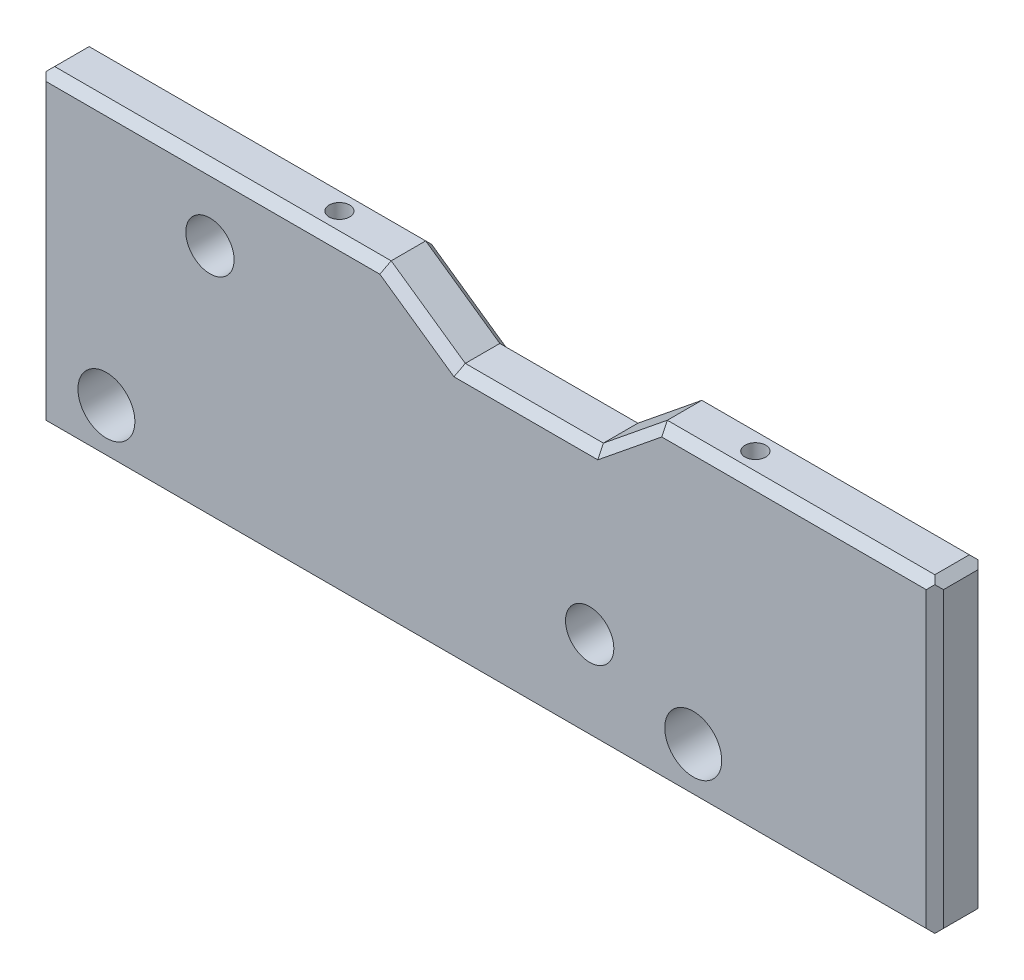
from build123d import *

# Parameters (mm, degrees)
SKETCH_1_R          = 1.4
SKETCH_1_R_2        = 1.65
EXTRUDE_1_DEPTH     = 3
SKETCH_2_R          = 0.6
CUT_EXTRUDE_1_DEPTH = 34.421549934
CHAMFER_2_SIZE      = 0.5
CHAMFER_3_SIZE      = 0.5


with BuildPart() as part:
    # 草图1 → 凸台-拉伸1 (new body)
    with BuildSketch(Plane.XY):
        Polygon((-8, 7), (-3.705865331, 4), (4.294134669, 4), (8, 7), (24, 7), (24, -11), (-28, -11), (-28, 7), align=None)
        with Locations((-18, 3)):
            Circle(SKETCH_1_R, mode=Mode.SUBTRACT)
        with Locations((4, -5.5)):
            Circle(SKETCH_1_R, mode=Mode.SUBTRACT)
        with Locations((-24, -8)):
            Circle(SKETCH_1_R_2, mode=Mode.SUBTRACT)
        with Locations((10, -8)):
            Circle(SKETCH_1_R_2, mode=Mode.SUBTRACT)
    extrude(amount=EXTRUDE_1_DEPTH)

    # 草图2 → 切除-拉伸1 (cut, through all)
    with BuildSketch(Plane.XZ.offset(11)):
        with Locations(Location((12.1, 1.5, 0), (0, 0, 270))):
            Circle(SKETCH_2_R)
        with Locations(Location((-12, 1.5, 0), (0, 0, 270))):
            Circle(SKETCH_2_R)
    extrude(amount=-CUT_EXTRUDE_1_DEPTH, mode=Mode.SUBTRACT)

    # 倒角2
    chamfer_2_edges = [part.edges().sort_by_distance(p)[0] for p in [
        (24, -2, 0),
        (24, -11, 1.5),
        (-28, -11, 1.5),
        (-28, 7, 1.5),
        (24, 7, 1.5),
        (-28, -2, 3),
        (24, -2, 3),
        (-28, -2, 0),
    ]]
    chamfer(chamfer_2_edges, length=CHAMFER_2_SIZE)

    # 倒角3
    chamfer_3_edges = [part.edges().sort_by_distance(p)[0] for p in [
        (0.294134669, 4, 0),
        (6.147067334, 5.5, 0),
        (6.147067334, 5.5, 3),
        (0.294134669, 4, 3),
        (-5.852932666, 5.5, 3),
        (-17.75, 7, 3),
        (15.75, 7, 3),
        (-2, -11, 3),
        (-2, -11, 0),
        (15.75, 7, 0),
        (-17.75, 7, 0),
        (-5.852932666, 5.5, 0),
    ]]
    chamfer(chamfer_3_edges, length=CHAMFER_3_SIZE)


solid = part.part
